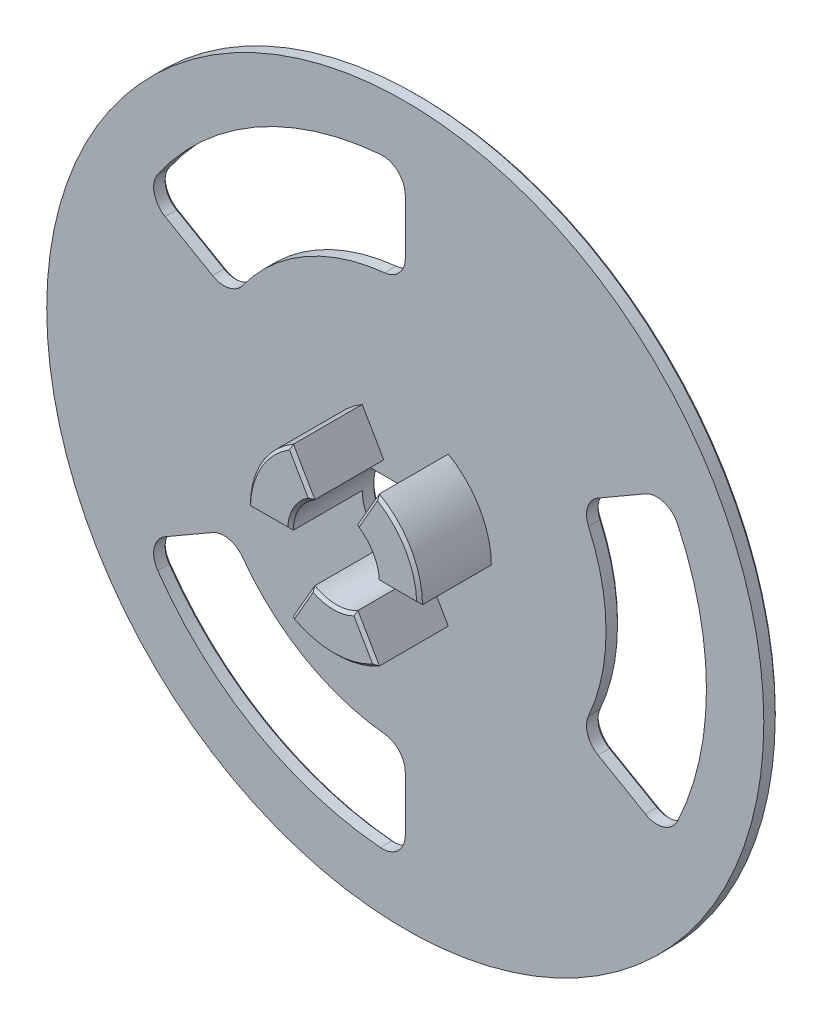
from build123d import *

# Parameters (mm, degrees)
SKETCH_1_R      = 25
EXTRUDE_1_DEPTH = 1
FILLET_1_R      = 1.6
EXTRUDE_START   = 5
EXTRUDE_3_DEPTH = 5
CHAMFER_3_SIZE  = 0.2


with BuildPart() as part:
    # 草图1 → 凸台-拉伸1 (new body)
    with BuildSketch(Plane.XY):
        Circle(SKETCH_1_R)
        with BuildLine():
            Line((-2.5, 1.658312395), (2.5, 1.658312395))
            ThreePointArc((2.5, 1.658312395), (0, -3), (-2.5, 1.658312395))
        make_face(mode=Mode.SUBTRACT)
        with BuildLine():
            ThreePointArc((-12.124355653, -7), (-7, -12.124355653), (0, -14))
            Line((0, -14), (0, -21))
            ThreePointArc((0, -21), (-10.5, -18.186533479), (-18.186533479, -10.5))
            Line((-18.186533479, -10.5), (-12.124355653, -7))
        make_face(mode=Mode.SUBTRACT)
        with BuildLine():
            ThreePointArc((0, 14), (-7, 12.124355653), (-12.124355653, 7))
            Line((-12.124355653, 7), (-18.186533479, 10.5))
            ThreePointArc((-18.186533479, 10.5), (-10.5, 18.186533479), (0, 21))
            Line((0, 21), (0, 14))
        make_face(mode=Mode.SUBTRACT)
        with BuildLine():
            Line((18.186533479, -10.5), (12.124355653, -7))
            ThreePointArc((12.124355653, -7), (14, 0), (12.124355653, 7))
            Line((12.124355653, 7), (18.186533479, 10.5))
            ThreePointArc((18.186533479, 10.5), (21, 0), (18.186533479, -10.5))
        make_face(mode=Mode.SUBTRACT)
    extrude(amount=-EXTRUDE_1_DEPTH)

    # 圆角1
    fillet_1_edges = [part.edges().sort_by_distance(p)[0] for p in [
        (-18.186533479, -10.5, -0.5),
        (0, -21, -0.5),
        (0, -14, -0.5),
        (-12.124355653, -7, -0.5),
        (18.186533479, -10.5, -0.5),
        (18.186533479, 10.5, -0.5),
        (12.124355653, 7, -0.5),
        (12.124355653, -7, -0.5),
        (-18.186533479, 10.5, -0.5),
        (-12.124355653, 7, -0.5),
        (0, 14, -0.5),
        (0, 21, -0.5),
    ]]
    fillet(fillet_1_edges, radius=FILLET_1_R)

    # 草图1<5> → 凸台-拉伸3 (add)
    with BuildSketch(Plane.XY.offset(EXTRUDE_START)):
        with BuildLine():
            ThreePointArc((-3, 0), (-2.598076211, 1.5), (-1.5, 2.598076211))
            Line((-1.5, 2.598076211), (-3, 5.196152423))
            ThreePointArc((-3, 5.196152423), (-5.196152423, 3), (-6, 0))
            Line((-6, 0), (-3, 0))
        make_face()
        with BuildLine():
            ThreePointArc((1.5, 2.598076211), (2.598076211, 1.5), (3, 0))
            Line((3, 0), (6, 0))
            ThreePointArc((6, 0), (5.196152423, 3), (3, 5.196152423))
            Line((3, 5.196152423), (1.5, 2.598076211))
        make_face()
        with BuildLine():
            ThreePointArc((1.5, -2.598076211), (0, -3), (-1.5, -2.598076211))
            Line((-1.5, -2.598076211), (-3, -5.196152423))
            ThreePointArc((-3, -5.196152423), (0, -6), (3, -5.196152423))
            Line((3, -5.196152423), (1.5, -2.598076211))
        make_face()
    extrude(amount=-EXTRUDE_3_DEPTH)

    # 倒角3
    chamfer_3_edges = [part.edges().sort_by_distance(p)[0] for p in [
        (-0.412026073, 14.44594919, -1),
        (-0.516287404, 20.511009142, -1),
        (0, 1.658312395, -1),
        (-4.5, 0, 5),
        (-2.598076211, 1.5, 5),
        (-2.25, 3.897114317, 5),
        (-5.196152423, 3, 5),
        (2.25, 3.897114317, 5),
        (2.598076211, 1.5, 5),
        (4.5, 0, 5),
        (5.196152423, 3, 5),
        (2.25, -3.897114317, 5),
        (0, -3, 5),
        (-2.25, -3.897114317, 5),
        (0, -6, 5),
        (-25, 0, -1),
        (-10.5, -18.186533479, -1),
        (-15.091202728, -8.712909958, -1),
        (-7, -12.124355653, -1),
        (0, -17.425819915, -1),
        (21, 0, -1),
        (15.091202728, -8.712909958, -1),
        (15.091202728, 8.712909958, -1),
        (14, 0, -1),
        (-15.091202728, 8.712909958, -1),
        (-10.5, 18.186533479, -1),
        (-7, 12.124355653, -1),
        (0, 17.425819915, -1),
        (-17.504911272, -10.702622579, -1),
        (0, -3, -1),
        (-12.304545944, -7.579799641, -1),
        (-0.412026073, -14.44594919, -1),
        (-0.516287404, -20.511009142, -1),
        (18.021198676, -9.808386563, -1),
        (18.021198676, 9.808386563, -1),
        (12.716572017, 6.866149549, -1),
        (12.716572017, -6.866149549, -1),
        (-17.504911272, 10.702622579, -1),
        (-12.304545944, 7.579799641, -1),
    ]]
    chamfer(chamfer_3_edges, length=CHAMFER_3_SIZE)


solid = part.part
